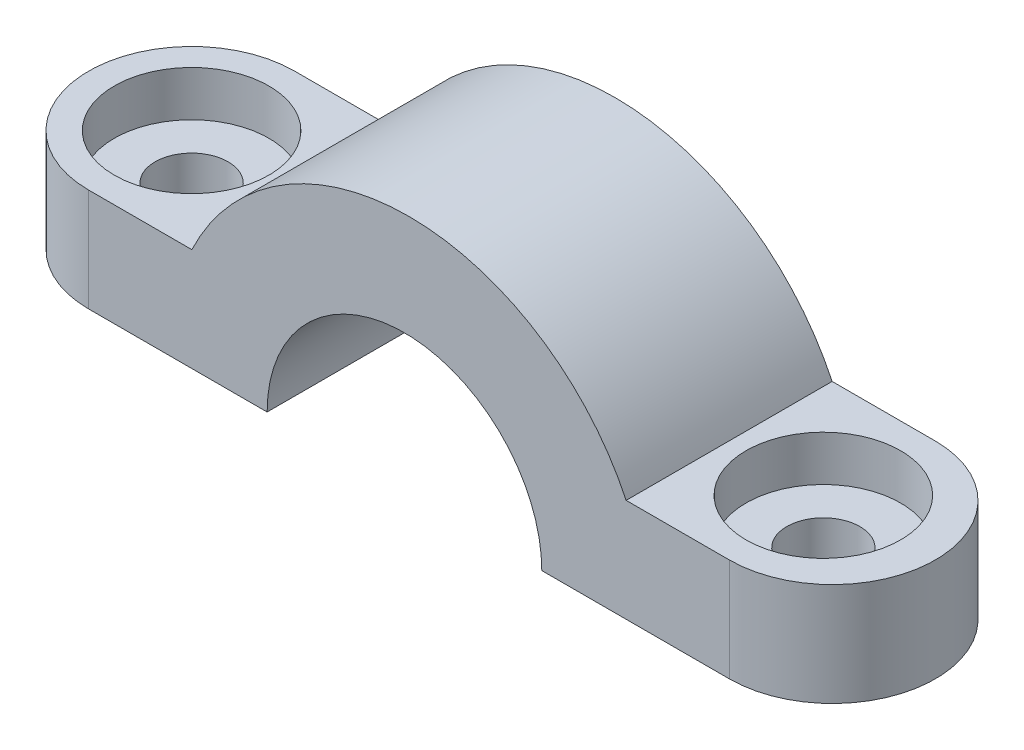
from build123d import *

# Parameters (mm, degrees)
BASE_EXTRUDE_DEPTH = 9.525
ARCH_EXTRUDE_DEPTH = 19.05
SKETCH3_R          = 12.7
ARCH_CUT_DEPTH     = 50.222663057
SKETCH4_R          = 7.1501
LARGE_CUT_DEPTH    = 4.191
SKETCH5_R          = 3.3782
SMALL_CUT_DEPTH    = 45.068684339


with BuildPart() as part:
    # Sketch1 → Base Extrude (new body)
    with BuildSketch(Plane(origin=(0, 0, 0), x_dir=(1, 0, 0), z_dir=(0, 1, 0))):
        with BuildLine():
            Line((-29.21, 9.525), (30.047938144, 9.525))
            ThreePointArc((30.047938144, 9.525), (39.572938144, 0), (30.047938144, -9.525))
            Line((30.047938144, -9.525), (-29.21, -9.525))
            ThreePointArc((-29.21, -9.525), (-38.735, 0), (-29.21, 9.525))
        make_face()
    extrude(amount=BASE_EXTRUDE_DEPTH)

    # Sketch2 → Arch Extrude (add)
    with BuildSketch(Plane.XY.offset(9.525)):
        with BuildLine():
            Line((-21.806030928, 0), (22.643969072, 0))
            ThreePointArc((22.643969072, 0), (22.101207406, 4.881717509), (20.499432214, 9.525))
            Line((20.499432214, 9.525), (-19.66149407, 9.525))
            ThreePointArc((-19.66149407, 9.525), (-21.263269262, 4.881717509), (-21.806030928, 0))
        make_face()
        with BuildLine():
            Line((-19.66149407, 9.525), (20.499432214, 9.525))
            ThreePointArc((20.499432214, 9.525), (0.418969072, 22.225), (-19.66149407, 9.525))
        make_face()
    extrude(amount=-ARCH_EXTRUDE_DEPTH)

    # Sketch3 → Arch Cut (cut, through all)
    with BuildSketch(Plane.XY.offset(9.525)):
        Circle(SKETCH3_R)
    extrude(amount=-ARCH_CUT_DEPTH, mode=Mode.SUBTRACT)

    # Sketch4 → Large Cut (cut)
    with BuildSketch(Plane(origin=(0, 9.525, 0), x_dir=(1, 0, 0), z_dir=(0, 1, 0))):
        with Locations(Location((-29.21, 0, 0), (0, 0, 270))):
            Circle(SKETCH4_R)
    large_cut = extrude(amount=-LARGE_CUT_DEPTH, mode=Mode.SUBTRACT)

    # Sketch5 → Small Cut (cut, through all)
    with BuildSketch(Plane(origin=(0, 5.334, 0), x_dir=(1, 0, 0), z_dir=(0, 1, 0))):
        with Locations(Location((-29.21, 0, 0), (0, 0, 270))):
            Circle(SKETCH5_R)
    small_cut = extrude(amount=-SMALL_CUT_DEPTH, mode=Mode.SUBTRACT)

    # Mirror 2: Large Cut, Small Cut across plane
    add(large_cut.mirror(Plane(origin=(0, 0, 0), x_dir=(0, 0, 1), z_dir=(1, 0, 0))), mode=Mode.SUBTRACT)
    add(small_cut.mirror(Plane(origin=(0, 0, 0), x_dir=(0, 0, 1), z_dir=(1, 0, 0))), mode=Mode.SUBTRACT)


solid = part.part
